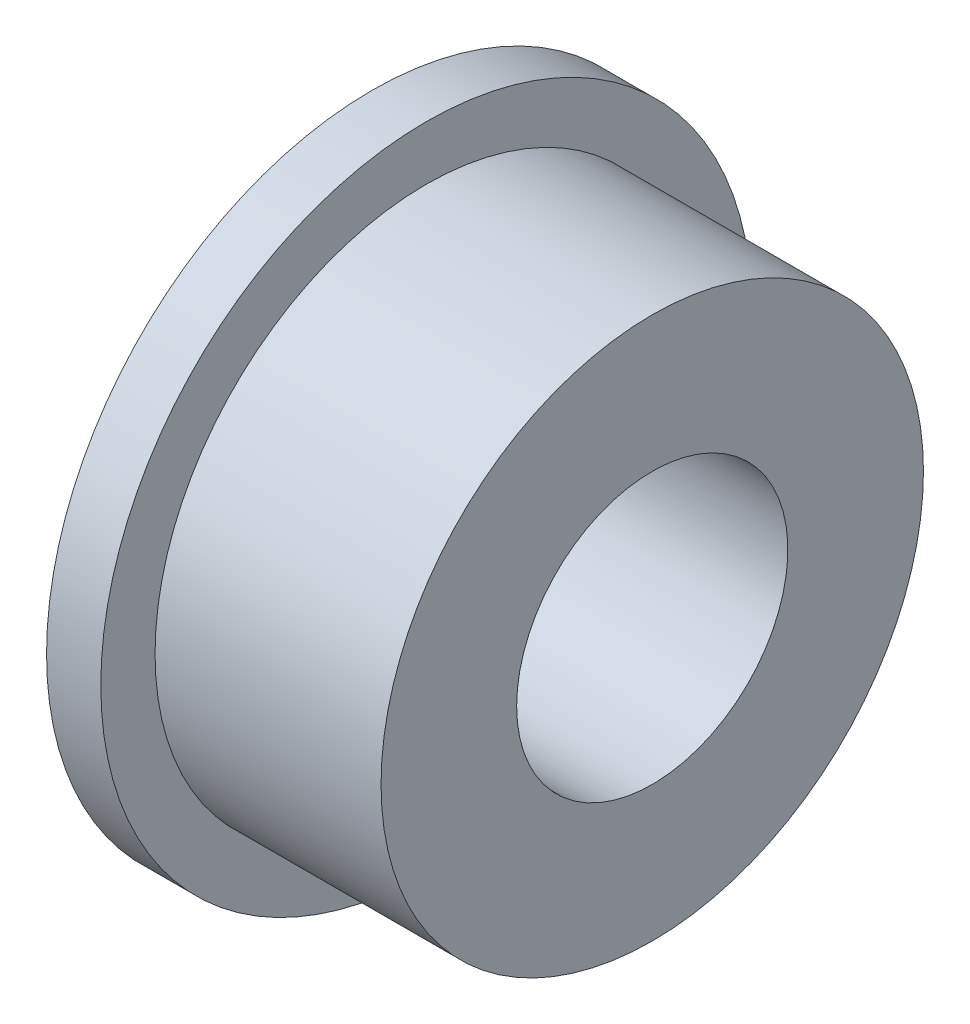
from build123d import *


with BuildPart() as part:
    # Sketch1 → Revolve1 (revolve)
    with BuildSketch(Plane.XY, mode=Mode.PRIVATE) as revolve1_sk:
        Polygon((0, 1.5), (0, 3.6), (0.6, 3.6), (0.6, 3), (3.1, 3), (3.1, 1.5), align=None)
    revolve(revolve1_sk.sketch.rotate(Axis((0, 0, 0), (1, 0, 0)), 90), axis=Axis((0, 0, 0), (1, 0, 0)))


solid = part.part
